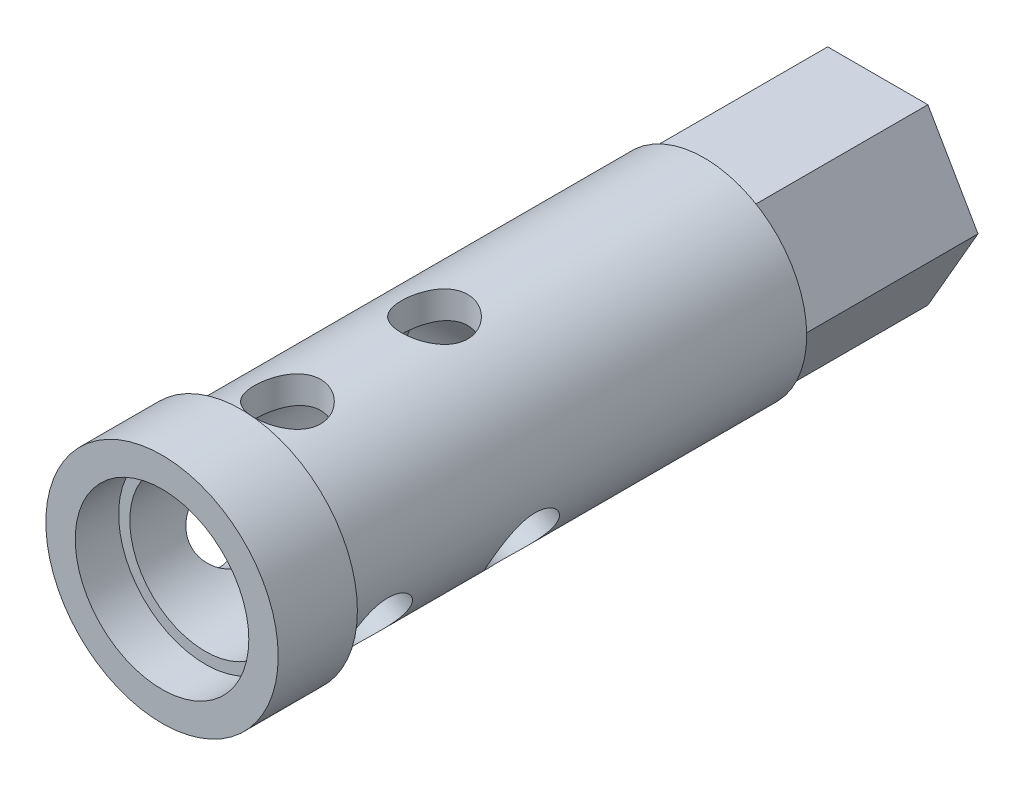
from build123d import *

# Parameters (mm, degrees)
BOSS_EXTRUDE1_DEPTH                  = 12.7
SKETCH3_W                            = 2.5527
SKETCH3_H                            = 12.7
F_11_0_191_DIAMETER_HOLE2_AT_2_COUNT = 2
F_11_0_191_DIAMETER_HOLE2_AT_2_PITCH = 10.762499938
CIRPATTERN1_COUNT                    = 3


with BuildPart() as part:
    # Sketch1 → Revolve1 (revolve)
    with BuildSketch(Plane(origin=(0, 0, 0), x_dir=(0, 0, -1), z_dir=(1, 0, 0)), mode=Mode.PRIVATE) as revolve1_sk:
        Polygon((29.864941698, 3.175), (30.341874814, 2.38125), (39.66874972, 2.38125), (39.66874972, 7.499999986), (5.793749906, 7.499999986), (5.793749906, 8.500000018), (0, 8.500000018), (0, 6.35), (3.175, 6.35), (3.175, 5.5315), (23.112499876, 5.5315), (24.528427925, 3.175), align=None)
    revolve(revolve1_sk.sketch.rotate(Axis((0, 0, 0), (0, 0, -1)), 90), axis=Axis((0, 0, 0), (0, 0, -1)))

    # Sketch2 → Boss-Extrude1 (add)
    with BuildSketch(Plane(origin=(0, 0, -39.66874972), x_dir=(-1, 0, 0), z_dir=(0, 0, -1))):
        Polygon((7.332348419, 0), (3.666174209, 6.35), (-3.666174209, 6.35), (-7.332348419, 0), (-3.666174209, -6.35), (3.666174209, -6.35), align=None)
    extrude(amount=BOSS_EXTRUDE1_DEPTH)

    # Sketch3 → 1/4-20 Tapped Hole1 (revolve, cut)
    with BuildSketch(Plane(origin=(0, 0, -39.66874972), x_dir=(0, -1, 0), z_dir=(1, 0, 0))):
        with Locations((1.27635, 6.35)):
            Rectangle(SKETCH3_W, SKETCH3_H)
    revolve(axis=Axis((0, 0, -33.31874972), (0, 0, -1)), mode=Mode.SUBTRACT)

    # Sketch12 → #11 (0.191) Diameter Hole2 (revolve, cut)
    with BuildSketch(Plane(origin=(0, 7.499999986, -9.174999938), x_dir=(0, 0, 1), z_dir=(1, 0, 0))):
        Polygon((0, 0), (0, 8.95650759), (2.4257, 7.498999986), (2.4257, 0), align=None)
    f_11_0_191_diameter_hole2 = revolve(axis=Axis((0, 13.849999986, -9.174999938), (0, -1, 0)), mode=Mode.SUBTRACT)

    # #11 (0.191) Diameter Hole2 at 2: #11 (0.191) Diameter Hole2 ×2
    with Locations(*[(0, 0, -i * F_11_0_191_DIAMETER_HOLE2_AT_2_PITCH) for i in range(1, F_11_0_191_DIAMETER_HOLE2_AT_2_COUNT)]):
        add(f_11_0_191_diameter_hole2, mode=Mode.SUBTRACT)

    # CirPattern1: #11 (0.191) Diameter Hole2 ×3 about axis
    cirpattern1_axis = Axis((0, 0, 0), (0, 0, 1))
    for i in range(1, CIRPATTERN1_COUNT):
        add(f_11_0_191_diameter_hole2.rotate(cirpattern1_axis, i * 360 / CIRPATTERN1_COUNT), mode=Mode.SUBTRACT)

    # CirPattern1 copy 1 sketch → CirPattern1 copy 1 (revolve, cut)
    with BuildSketch(Plane(origin=(-6.495190516, -3.749999993, -19.937499876), x_dir=(0, 0, 1), z_dir=(-0.4999999999999998, 0.8660254037844387, 0))):
        Polygon((0, 0), (0, 8.95650759), (2.4257, 7.498999986), (2.4257, 0), align=None)
    revolve(axis=Axis((-11.99445183, -6.924999993, -19.937499876), (0.8660254037844387, 0.4999999999999998, 0)), mode=Mode.SUBTRACT)

    # CirPattern1 copy 2 sketch → CirPattern1 copy 2 (revolve, cut)
    with BuildSketch(Plane(origin=(6.495190516, -3.749999993, -19.937499876), x_dir=(0, 0, 1), z_dir=(-0.5000000000000004, -0.8660254037844384, 0))):
        Polygon((0, 0), (0, 8.95650759), (2.4257, 7.498999986), (2.4257, 0), align=None)
    revolve(axis=Axis((11.99445183, -6.924999993, -19.937499876), (-0.8660254037844384, 0.5000000000000004, 0)), mode=Mode.SUBTRACT)


solid = part.part
